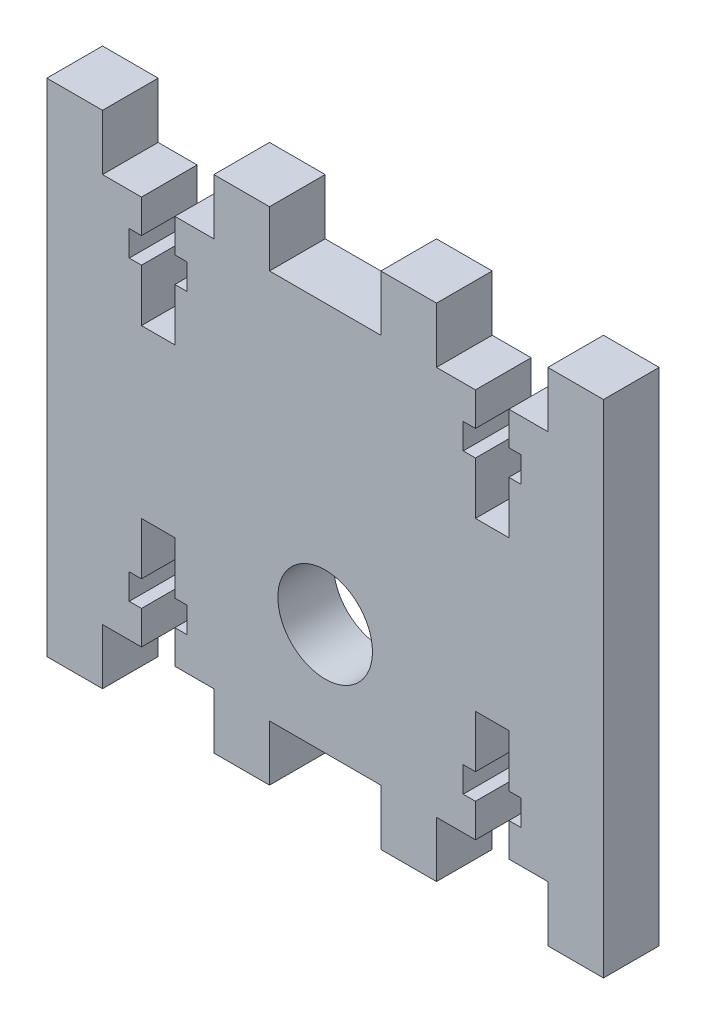
from build123d import *

# Parameters (mm, degrees)
ESQUISSE1_R        = 4.25
BOSS_EXTRU_1_DEPTH = 5


with BuildPart() as part:
    # Esquisse1 → Boss.-Extru.1 (new body)
    # profile 1 of 2: a face of its own
    with BuildSketch(Plane.XY):
        Polygon((-10, 22.5), (-10, 17.5), (-10, -17.5), (-10, -22.5), (-5, -22.5), (-5, -17.5), (-1.5, -17.5), (-1.5, -14.5), (-2.6, -14.5), (-2.6, -12.2), (-1.5, -12.2), (-1.5, -7.5), (1.5, -7.5), (1.5, -12.2), (2.6, -12.2), (2.6, -14.5), (1.5, -14.5), (1.5, -17.5), (5, -17.5), (5, -22.5), (10, -22.5), (10, -17.5), (10, 17.5), (10, 22.5), (5, 22.5), (5, 17.5), (1.5, 17.5), (1.5, 14.5), (2.6, 14.5), (2.6, 12.2), (1.5, 12.2), (1.5, 7.5), (-1.5, 7.5), (-1.5, 12.2), (-2.6, 12.2), (-2.6, 14.5), (-1.5, 14.5), (-1.5, 17.5), (-5, 17.5), (-5, 22.5), align=None)
    # profile 2 of 2: a face of its own
    with BuildSketch(Plane.XY):
        Polygon((20, 17.5), (10, 17.5), (10, -17.5), (20, -17.5), (20, -22.5), (25, -22.5), (25, -17.5), (28.5, -17.5), (28.5, -14.5), (27.4, -14.5), (27.4, -12.2), (28.5, -12.2), (28.5, -7.5), (31.5, -7.5), (31.5, -12.2), (32.6, -12.2), (32.6, -14.5), (31.5, -14.5), (31.5, -17.5), (35, -17.5), (35, -22.5), (40, -22.5), (40, -17.5), (40, 17.5), (40, 22.5), (35, 22.5), (35, 17.5), (31.5, 17.5), (31.5, 14.5), (32.6, 14.5), (32.6, 12.2), (31.5, 12.2), (31.5, 7.5), (28.5, 7.5), (28.5, 12.2), (27.4, 12.2), (27.4, 14.5), (28.5, 14.5), (28.5, 17.5), (25, 17.5), (25, 22.5), (20, 22.5), align=None)
        with Locations((15, -7.5)):
            Circle(ESQUISSE1_R, mode=Mode.SUBTRACT)
    extrude(amount=BOSS_EXTRU_1_DEPTH)


solid = part.part
